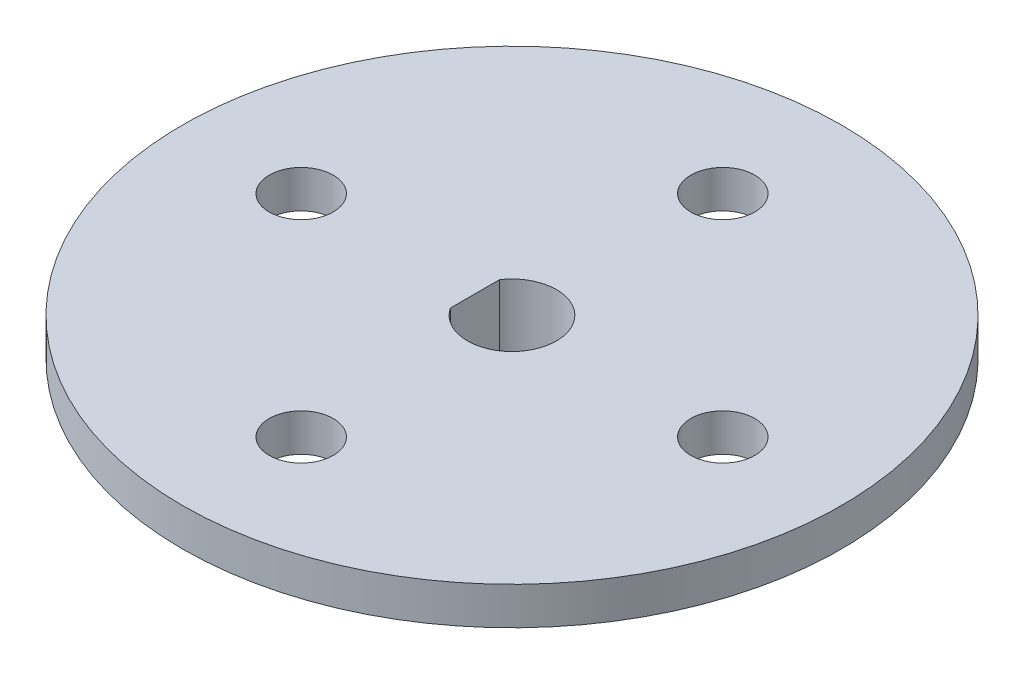
from build123d import *

# Parameters (mm, degrees)
SKETCH1_R           = 22.225
SKETCH1_R_2         = 2.159
BOSS_EXTRUDE1_DEPTH = 2.54
BOSS_EXTRUDE2_START = -2.54
SKETCH1_4_R         = 9.525
BOSS_EXTRUDE2_DEPTH = 2.54


with BuildPart() as part:
    # Sketch1 → Boss-Extrude1 (new body)
    with BuildSketch(Plane(origin=(0, 0, 0), x_dir=(1, 0, 0), z_dir=(0, 1, 0))):
        Circle(SKETCH1_R)
        with BuildLine():
            Line((-2.5, -1.658312395), (-2.5, 1.658312395))
            ThreePointArc((-2.5, 1.658312395), (3, 0), (-2.5, -1.658312395))
        make_face(mode=Mode.SUBTRACT)
        with Locations((0, -14.21564213)):
            Circle(SKETCH1_R_2, mode=Mode.SUBTRACT)
        with Locations((14.21564213, 0)):
            Circle(SKETCH1_R_2, mode=Mode.SUBTRACT)
        with Locations((-14.21564213, 0)):
            Circle(SKETCH1_R_2, mode=Mode.SUBTRACT)
        with Locations((0, 14.21564213)):
            Circle(SKETCH1_R_2, mode=Mode.SUBTRACT)
    extrude(amount=BOSS_EXTRUDE1_DEPTH)

    # Sketch1<4> → Boss-Extrude2 (add)
    with BuildSketch(Plane(origin=(0, 0, 0), x_dir=(1, 0, 0), z_dir=(0, 1, 0)).offset(BOSS_EXTRUDE2_START)):
        Circle(SKETCH1_4_R)
        with BuildLine():
            Line((-2.5, -1.658312395), (-2.5, 1.658312395))
            ThreePointArc((-2.5, 1.658312395), (3, 0), (-2.5, -1.658312395))
        make_face(mode=Mode.SUBTRACT)
    extrude(amount=BOSS_EXTRUDE2_DEPTH)


solid = part.part
